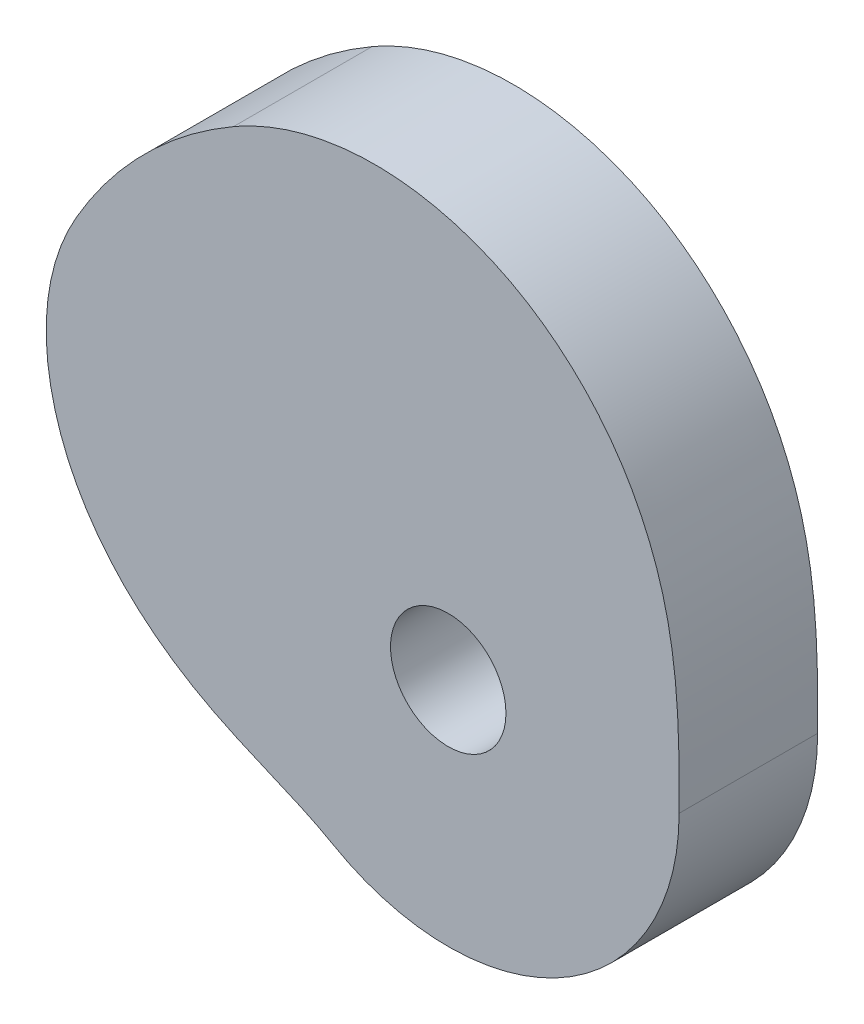
from build123d import *

# Parameters (mm, degrees)
SKETCH2_R           = 12.5
BOSS_EXTRUDE1_DEPTH = 15


with BuildPart() as part:
    # Sketch2 → Boss-Extrude1 (new, symmetric)
    with BuildSketch(Plane.XY):
        with BuildLine():
            ThreePointArc((-25, -43.301270189), (25, -43.301270189), (50, 0))
            add(Edge.make_bspline(
                [(50, 0), (50, 5.9743789), (50.060204805, 19.153466901), (47.336306516, 40.629698689), (36.605550445, 63.925706776), (14.837765348, 83.47937862), (-16.036151317, 91.500359053), (-37.028144976, 86.0089406), (-46.5, 80.540362552)],
                knots=[0, 0, 0, 0, 0.115850128, 0.251620343, 0.413575869, 0.597518573, 0.795537987, 1, 1, 1, 1], degree=3))
            ThreePointArc((-46.5, 80.540362552), (-65.76093065, 65.76093065), (-80.540362552, 46.5))
            add(Edge.make_bspline(
                [(-80.540362552, 46.5), (-84.677739575, 39.333852786), (-88.984807521, 23.508055578), (-83.903495936, -0.398811065), (-70.457282721, -18.813024137), (-53.932446022, -30.410798629), (-38.313686898, -36.970503945), (-28.970010712, -41.009183436), (-25, -43.301270189)],
                knots=[0, 0, 0, 0, 0.198313599, 0.394495842, 0.581696629, 0.748830999, 0.886895994, 1, 1, 1, 1], degree=3))
        make_face()
        Circle(SKETCH2_R, mode=Mode.SUBTRACT)
    extrude(amount=BOSS_EXTRUDE1_DEPTH, both=True)


solid = part.part
